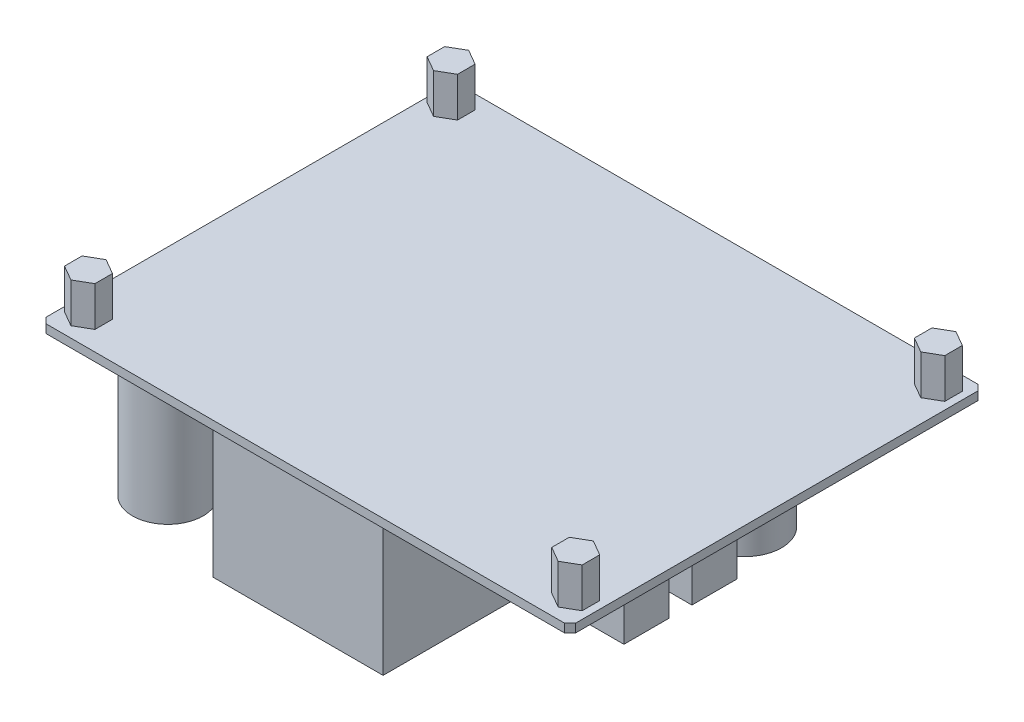
from build123d import *

# Parameters (mm, degrees)
SKETCH_1_W       = 93.5
SKETCH_1_H       = 73
EXTRUDE_1_DEPTH  = 1.5
CHAMFER_1_SIZE   = 1
EXTRUDE_2_DEPTH  = 7
SKETCH_3_W       = 30
SKETCH_3_H       = 30
EXTRUDE_3_DEPTH  = 24
SKETCH_4_R       = 6.25
EXTRUDE_4_DEPTH  = 21
SKETCH_5_R       = 6.25
EXTRUDE_5_DEPTH  = 21
SKETCH_6_R       = 6.25
EXTRUDE_6_DEPTH  = 21
SKETCH_8_W       = 8
SKETCH_8_H       = 8
EXTRUDE_7_DEPTH  = 7.5
SKETCH_9_R       = 6.5
EXTRUDE_9_DEPTH  = 20.5
SKETCH_10_W      = 22.5
SKETCH_10_H      = 5.6
EXTRUDE_10_DEPTH = 10


with BuildPart() as part:
    # Эскиз1 → Бобышка-Вытянуть1 (new body)
    with BuildSketch(Plane(origin=(0, 0, 0), x_dir=(1, 0, 0), z_dir=(0, 1, 0))):
        Rectangle(SKETCH_1_W, SKETCH_1_H)
    extrude(amount=EXTRUDE_1_DEPTH)

    # Фаска1
    chamfer_1_edges = [part.edges().sort_by_distance(p)[0] for p in [
        (46.75, 0.75, 36.5),
        (-46.75, 0.75, 36.5),
        (-46.75, 0.75, -36.5),
        (46.75, 0.75, -36.5),
    ]]
    chamfer(chamfer_1_edges, length=CHAMFER_1_SIZE)

    # Эскиз2 → Бобышка-Вытянуть2 (add)
    with BuildSketch(Plane(origin=(0, 1.5, 0), x_dir=(1, 0, 0), z_dir=(0, 1, 0))):
        Polygon((42.75, 35.6), (40.065321248, 34.05), (40.065321248, 30.95), (42.75, 29.4), (45.434678752, 30.95), (45.434678752, 34.05), align=None)
        Polygon((-43.25, 35.6), (-45.934678752, 34.05), (-45.934678752, 30.95), (-43.25, 29.4), (-40.565321248, 30.95), (-40.565321248, 34.05), align=None)
        Polygon((42.75, -28.4), (40.065321248, -29.95), (40.065321248, -33.05), (42.75, -34.6), (45.434678752, -33.05), (45.434678752, -29.95), align=None)
        Polygon((-43.25, -28.4), (-45.934678752, -29.95), (-45.934678752, -33.05), (-43.25, -34.6), (-40.565321248, -33.05), (-40.565321248, -29.95), align=None)
    extrude(amount=EXTRUDE_2_DEPTH)

    # Эскиз3 → Бобышка-Вытянуть3 (add)
    with BuildSketch(Plane.XZ):
        with Locations((-2.75, 20)):
            Rectangle(SKETCH_3_W, SKETCH_3_H)
    extrude(amount=EXTRUDE_3_DEPTH)

    # Эскиз4 → Бобышка-Вытянуть4 (add)
    with BuildSketch(Plane.XZ):
        with Locations(Location((-31.25, 29.5, 0), (0, 0, 90))):
            Circle(SKETCH_4_R)
    extrude(amount=EXTRUDE_4_DEPTH)

    # Эскиз5 → Бобышка-Вытянуть5 (add)
    with BuildSketch(Plane.XZ):
        with Locations(Location((-28.75, 16.5, 0), (0, 0, 90))):
            Circle(SKETCH_5_R)
    extrude(amount=EXTRUDE_5_DEPTH)

    # Эскиз6 → Бобышка-Вытянуть6 (add)
    with BuildSketch(Plane.XZ):
        with Locations(Location((-30.75, 3.5, 0), (0, 0, 90))):
            Circle(SKETCH_6_R)
    extrude(amount=EXTRUDE_6_DEPTH)

    # Эскиз8 → Бобышка-Вытянуть7 (add)
    with BuildSketch(Plane.XZ):
        with Locations((-41.25, 21.5)):
            Rectangle(SKETCH_8_W, SKETCH_8_H)
        with Locations((-41.25, 9.5)):
            Rectangle(SKETCH_8_W, SKETCH_8_H)
        with Locations((41.25, 21.5)):
            Rectangle(SKETCH_8_W, SKETCH_8_H)
        with Locations((41.25, 9.5)):
            Rectangle(SKETCH_8_W, SKETCH_8_H)
    extrude(amount=EXTRUDE_7_DEPTH)

    # Эскиз9 → Бобышка-Вытянуть9 (add)
    with BuildSketch(Plane.XZ):
        with Locations(Location((16.917714538, -5.160483157, 0), (0, 0, 90))):
            Circle(SKETCH_9_R)
        with Locations(Location((24.917714538, -16.160483157, 0), (0, 0, 90))):
            Circle(SKETCH_9_R)
    extrude(amount=EXTRUDE_9_DEPTH)

    # Эскиз10 → Бобышка-Вытянуть10 (add)
    with BuildSketch(Plane.XZ):
        with Locations((-23.9, -32.107649626)):
            Rectangle(SKETCH_10_W, SKETCH_10_H)
        with Locations((24.6, -32.107649626)):
            Rectangle(SKETCH_10_W, SKETCH_10_H)
    extrude(amount=EXTRUDE_10_DEPTH)


solid = part.part
